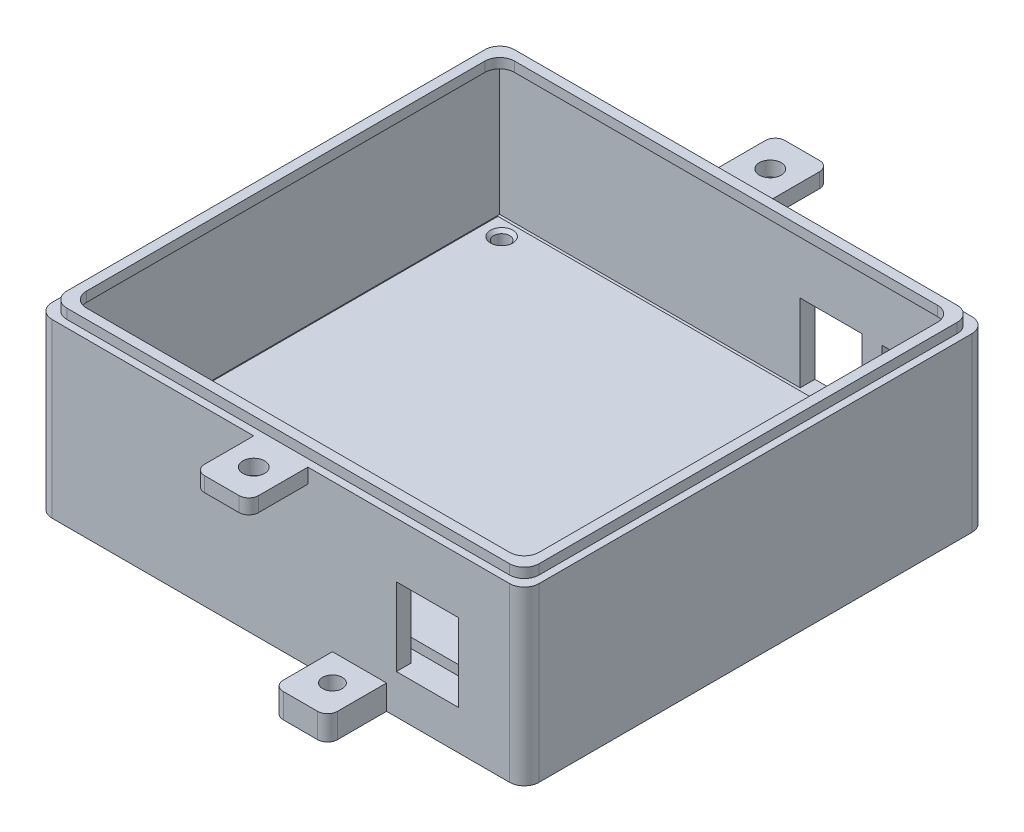
from build123d import *

# Parameters (mm, degrees)
ESBO_O1_W                        = 93
ESBO_O1_H                        = 88
RESSALTO_EXTRUS_O2_DEPTH         = 35
ESBO_O1_5_W                      = 93
ESBO_O1_5_H                      = 88
RESSALTO_EXTRUS_O3_DEPTH         = 8
ESBO_O1_7_R                      = 2
RESSALTO_EXTRUS_O6_DEPTH         = 5
ESBO_O4_R                        = 2.218632056
RESSALTO_EXTRUS_O7_DEPTH         = 3
ESBO_O5_W                        = 88.65
ESBO_O5_H                        = 82.92
RESSALTO_EXTRUS_O8_DEPTH         = 2
ESBO_O7_W                        = 12.6
ESBO_O7_H                        = 15.81
CORTE_EXTRUS_O1_DEPTH            = 146.086181285
ESBO_O8_W                        = 12.6
ESBO_O8_H                        = 15.81
CORTE_EXTRUS_O2_DEPTH            = 146.086181285
FURO_COM_FOLGA_DE_41_D           = 3.2639
FURO_COM_FOLGA_DE_41_DEPTH       = 8
FURO_COM_FOLGA_DE_41_CSINK_D     = 4.5339
FURO_COM_FOLGA_DE_41_CSINK_ANGLE = 90
FURO_COM_FOLGA_DE_41_TIP         = 0.980574487
RESSALTO_EXTRUS_O10_DEPTH        = 2


with BuildPart() as part:
    # Esboço1 → Ressalto-extrusão2 (new body)
    with BuildSketch(Plane(origin=(0, 0, 0), x_dir=(1, 0, 0), z_dir=(0, 1, 0))):
        with BuildLine():
            ThreePointArc((-3, 0), (-2.121320344, -2.121320344), (0, -3))
            Line((0, -3), (57, -3))
            Line((57, -3), (68, -3))
            Line((68, -3), (93, -3))
            ThreePointArc((93, -3), (95.121320344, -2.121320344), (96, 0))
            Line((96, 0), (96, 88))
            ThreePointArc((96, 88), (95.121320344, 90.121320344), (93, 91))
            Line((93, 91), (0, 91))
            ThreePointArc((0, 91), (-2.121320344, 90.121320344), (-3, 88))
            Line((-3, 88), (-3, 49.5))
            Line((-3, 49.5), (-3, 38.5))
            Line((-3, 38.5), (-3, 0))
        make_face()
        with Locations((46.5, 44)):
            Rectangle(ESBO_O1_W, ESBO_O1_H, mode=Mode.SUBTRACT)
    extrude(amount=RESSALTO_EXTRUS_O2_DEPTH)

    # Esboço1<5> → Ressalto-extrusão3 (add)
    with BuildSketch(Plane(origin=(0, 0, 0), x_dir=(1, 0, 0), z_dir=(0, 1, 0))):
        with Locations((46.5, 44)):
            Rectangle(ESBO_O1_5_W, ESBO_O1_5_H)
    extrude(amount=RESSALTO_EXTRUS_O3_DEPTH)

    # Esboço1<7> → Ressalto-extrusão6 (add)
    # profile 1 of 2: a face of its own
    with BuildSketch(Plane(origin=(0, 0, 0), x_dir=(1, 0, 0), z_dir=(0, 1, 0))):
        with BuildLine():
            Line((68, -3), (57, -3))
            Line((57, -3), (57, -13))
            ThreePointArc((57, -13), (57.585786438, -14.414213562), (59, -15))
            Line((59, -15), (66, -15))
            ThreePointArc((66, -15), (67.414213562, -14.414213562), (68, -13))
            Line((68, -13), (68, -3))
        make_face()
        with Locations((62.5, -8.5)):
            Circle(ESBO_O1_7_R, mode=Mode.SUBTRACT)
    # profile 2 of 2: a face of its own
    with BuildSketch(Plane(origin=(0, 0, 0), x_dir=(1, 0, 0), z_dir=(0, 1, 0))):
        with BuildLine():
            Line((-13, 38.5), (-3, 38.5))
            Line((-3, 38.5), (-3, 49.5))
            Line((-3, 49.5), (-13, 49.5))
            ThreePointArc((-13, 49.5), (-14.414213562, 48.914213562), (-15, 47.5))
            Line((-15, 47.5), (-15, 40.5))
            ThreePointArc((-15, 40.5), (-14.414213562, 39.085786438), (-13, 38.5))
        make_face()
        with Locations((-8.5, 44)):
            Circle(ESBO_O1_7_R, mode=Mode.SUBTRACT)
    extrude(amount=RESSALTO_EXTRUS_O6_DEPTH)

    # Esboço4 → Ressalto-extrusão7 (add)
    # profile 1 of 2: a face of its own
    with BuildSketch(Plane(origin=(0, 35, 0), x_dir=(1, 0, 0), z_dir=(0, 1, 0))):
        with BuildLine():
            Line((41, -3), (52, -3))
            Line((52, -3), (52, -13))
            ThreePointArc((52, -13), (51.414213562, -14.414213562), (50, -15))
            Line((50, -15), (43, -15))
            ThreePointArc((43, -15), (41.585786438, -14.414213562), (41, -13))
            Line((41, -13), (41, -3))
        make_face()
        with Locations((46.5, -8.5)):
            Circle(ESBO_O4_R, mode=Mode.SUBTRACT)
    # profile 2 of 2: a face of its own
    with BuildSketch(Plane(origin=(0, 35, 0), x_dir=(1, 0, 0), z_dir=(0, 1, 0))):
        with BuildLine():
            Line((43, 103), (50, 103))
            ThreePointArc((50, 103), (51.414213562, 102.414213562), (52, 101))
            Line((52, 101), (52, 91))
            Line((52, 91), (41, 91))
            Line((41, 91), (41, 101))
            ThreePointArc((41, 101), (41.585786438, 102.414213562), (43, 103))
        make_face()
        with Locations((46.5, 96.5)):
            Circle(ESBO_O4_R, mode=Mode.SUBTRACT)
    extrude(amount=-RESSALTO_EXTRUS_O7_DEPTH)

    # Esboço5 → Ressalto-extrusão8 (add)
    with BuildSketch(Plane(origin=(0, 8, 0), x_dir=(1, 0, 0), z_dir=(0, 1, 0))):
        with Locations((46.5, 44)):
            Rectangle(ESBO_O5_W, ESBO_O5_H)
    extrude(amount=RESSALTO_EXTRUS_O8_DEPTH)

    # Esboço7 → Corte-extrusão1 (cut, through all)
    with BuildSketch(Plane.XY.offset(-88)):
        with Locations((67.38, 15.905)):
            Rectangle(ESBO_O7_W, ESBO_O7_H)
        with Locations((84.02, 15.905)):
            Rectangle(ESBO_O7_W, ESBO_O7_H)
    extrude(amount=-CORTE_EXTRUS_O1_DEPTH, mode=Mode.SUBTRACT)

    # Esboço8 → Corte-extrusão2 (cut, through all)
    with BuildSketch(Plane(origin=(0, 0, 0), x_dir=(-1, 0, 0), z_dir=(0, 0, -1))):
        with Locations((-76.29, 15.905)):
            Rectangle(ESBO_O8_W, ESBO_O8_H)
    extrude(amount=-CORTE_EXTRUS_O2_DEPTH, mode=Mode.SUBTRACT)

    # Furo com folga de #41
    with Locations(Plane(origin=(6.12, 10, -82.28), x_dir=(0, 0, 1), z_dir=(0, 1, 0))):
        with Locations((0, 0), (76.45, 0), (76.45, 80.77)):
            CounterSinkHole(FURO_COM_FOLGA_DE_41_D / 2, FURO_COM_FOLGA_DE_41_CSINK_D / 2, depth=FURO_COM_FOLGA_DE_41_DEPTH, counter_sink_angle=FURO_COM_FOLGA_DE_41_CSINK_ANGLE)
            with Locations((0, 0, -(FURO_COM_FOLGA_DE_41_DEPTH + FURO_COM_FOLGA_DE_41_TIP / 2))):  # 118° drill point
                Cone(0, FURO_COM_FOLGA_DE_41_D / 2, FURO_COM_FOLGA_DE_41_TIP, mode=Mode.SUBTRACT)

    # Esboço14 → Ressalto-extrusão10 (add)
    with BuildSketch(Plane(origin=(0, 35, 0), x_dir=(1, 0, 0), z_dir=(0, 1, 0))):
        with BuildLine():
            Line((1.5, 89.5), (91.5, 89.5))
            ThreePointArc((91.5, 89.5), (93.621320344, 88.621320344), (94.5, 86.5))
            Line((94.5, 86.5), (94.5, 1.5))
            ThreePointArc((94.5, 1.5), (93.621320344, -0.621320344), (91.5, -1.5))
            Line((91.5, -1.5), (1.5, -1.5))
            ThreePointArc((1.5, -1.5), (-0.621320344, -0.621320344), (-1.5, 1.5))
            Line((-1.5, 1.5), (-1.5, 86.5))
            ThreePointArc((-1.5, 86.5), (-0.621320344, 88.621320344), (1.5, 89.5))
        make_face()
        with BuildLine():
            Line((3.5, 87.5), (89.5, 87.5))
            ThreePointArc((89.5, 87.5), (91.621320344, 86.621320344), (92.5, 84.5))
            Line((92.5, 84.5), (92.5, 3.5))
            ThreePointArc((92.5, 3.5), (91.621320344, 1.378679656), (89.5, 0.5))
            Line((89.5, 0.5), (3.5, 0.5))
            ThreePointArc((3.5, 0.5), (1.378679656, 1.378679656), (0.5, 3.5))
            Line((0.5, 3.5), (0.5, 84.5))
            ThreePointArc((0.5, 84.5), (1.378679656, 86.621320344), (3.5, 87.5))
        make_face(mode=Mode.SUBTRACT)
    extrude(amount=RESSALTO_EXTRUS_O10_DEPTH)


solid = part.part
